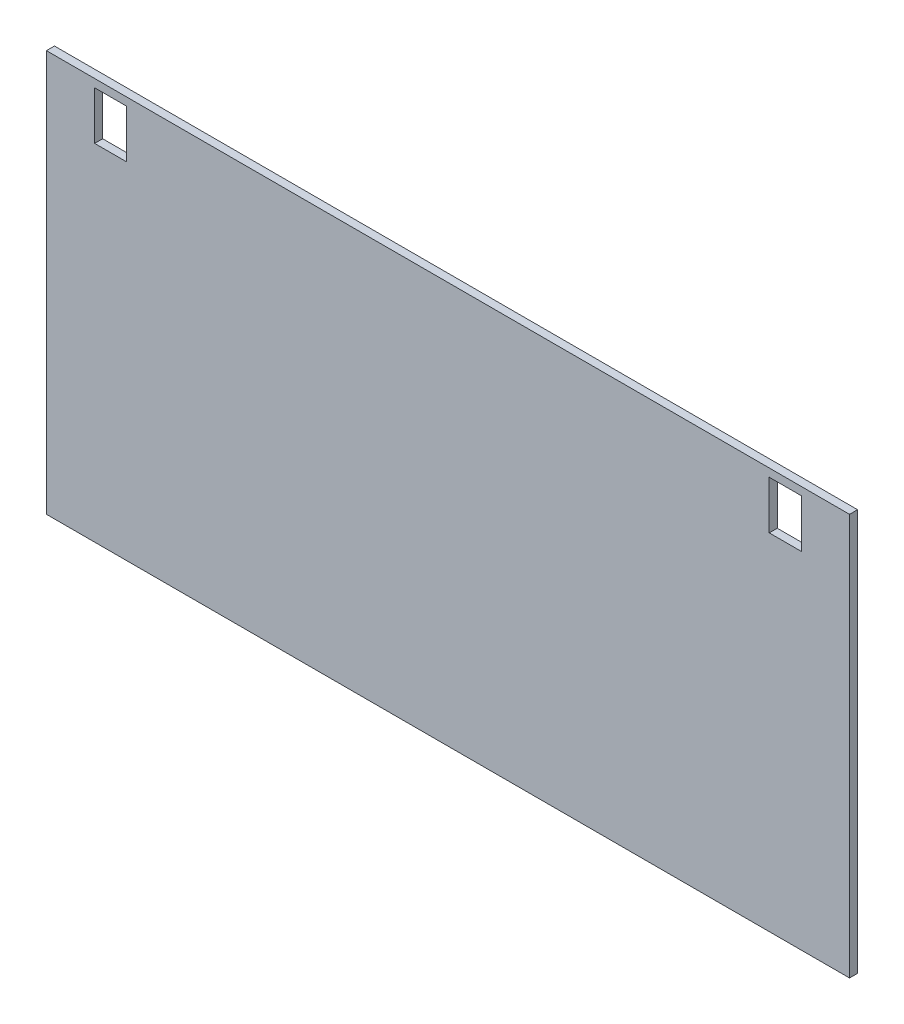
from build123d import *

# Parameters (mm, degrees)
SKETCH_1_W      = 100
SKETCH_1_H      = 50
SKETCH_1_W_2    = 4
SKETCH_1_H_2    = 6
EXTRUDE_1_DEPTH = 0.5


with BuildPart() as part:
    # 草圖1 → 填料-伸長1 (new, symmetric)
    with BuildSketch(Plane.XY):
        Rectangle(SKETCH_1_W, SKETCH_1_H)
        with Locations((-42, 21)):
            Rectangle(SKETCH_1_W_2, SKETCH_1_H_2, mode=Mode.SUBTRACT)
        with Locations((42, 21)):
            Rectangle(SKETCH_1_W_2, SKETCH_1_H_2, mode=Mode.SUBTRACT)
    extrude(amount=EXTRUDE_1_DEPTH, both=True)


solid = part.part
